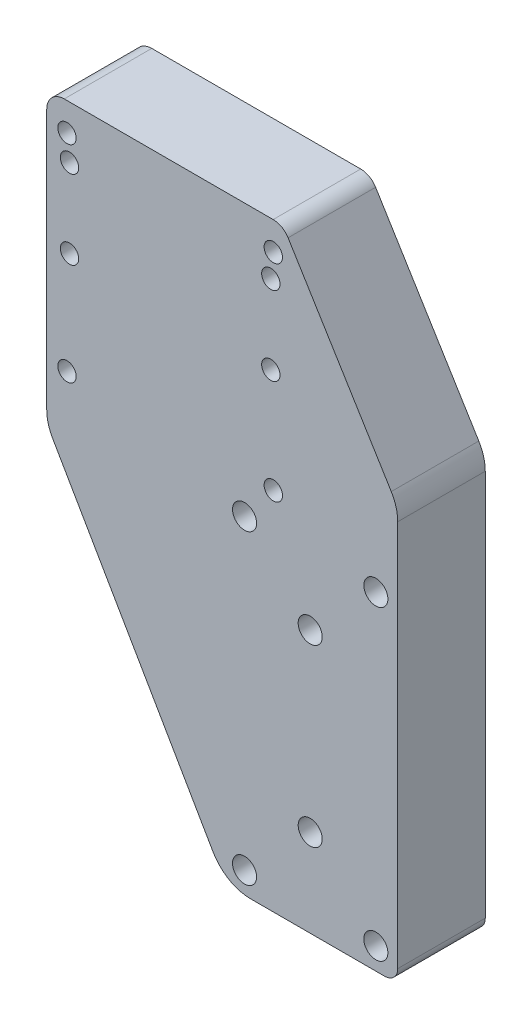
from build123d import *

# Parameters (mm, degrees)
BOSS_EXTRUDE1_DEPTH     = 20
FILLET1_R               = 10
TAP_DRILL_FOR_M5_TAP1_D = 4.2
M5_CLEARANCE_HOLE1_D    = 5.5
TAP_DRILL_FOR_M5_TAP2_D = 4.2
FILLET2_R               = 4


with BuildPart() as part:
    # Sketch1 → Boss-Extrude1 (new body)
    with BuildSketch(Plane.XY):
        with BuildLine():
            Line((-170.200000001, 540.824594888), (-129.309401077, 470))
            Line((-129.309401077, 470), (-93, 470))
            ThreePointArc((-93, 470), (-90.878679656, 470.878679656), (-90, 473))
            Line((-90, 473), (-90, 564.25527297))
            Line((-90, 564.25527297), (-116.225329238, 607))
            Line((-116.225329238, 607), (-170.200000001, 607))
            Line((-170.200000001, 607), (-170.200000001, 540.824594888))
        make_face()
    extrude(amount=BOSS_EXTRUDE1_DEPTH)

    # Fillet1
    fillet1_edges = [part.edges().sort_by_distance(p)[0] for p in [
        (-90, 564.25527297, 10),
        (-129.309401077, 470, 10),
        (-170.200000001, 540.824594888, 10),
    ]]
    fillet(fillet1_edges, radius=FILLET1_R)

    # Tap Drill for M5 Tap1 (through all)
    with Locations(Plane(origin=(0, 0, 0), x_dir=(-1, 0, 0), z_dir=(0, 0, -1))):
        with Locations((119.000000001, 595), (119.000000001, 577), (165.000000001, 577), (165.000000001, 595)):
            Hole(TAP_DRILL_FOR_M5_TAP1_D / 2)

    # M5 Clearance Hole1 (through all)
    with Locations(Plane.XY.offset(20)):
        with Locations((-95, 545), (-125, 545), (-125, 475), (-95, 475), (-110, 490), (-110, 530)):
            Hole(M5_CLEARANCE_HOLE1_D / 2)

    # Tap Drill for M5 Tap2 (through all)
    with Locations(Plane.XY.offset(20)):
        with Locations((-165.570000001, 553.43), (-165.570000001, 600.57), (-118.430000001, 553.43), (-118.430000001, 600.57)):
            Hole(TAP_DRILL_FOR_M5_TAP2_D / 2)

    # Fillet2
    fillet2_edges = [part.edges().sort_by_distance(p)[0] for p in [
        (-116.225329238, 607, 10),
        (-170.200000001, 607, 10),
    ]]
    fillet(fillet2_edges, radius=FILLET2_R)


solid = part.part
